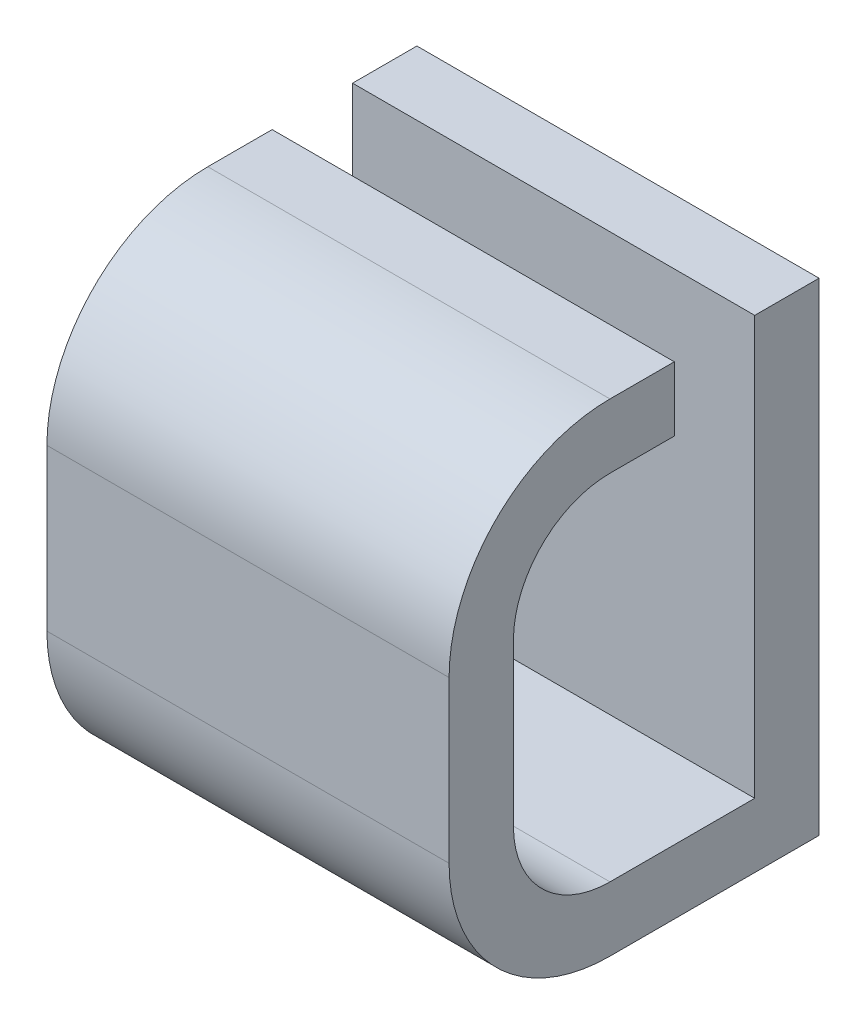
from build123d import *

# Parameters (mm, degrees)
EXTRUDE_1_DEPTH = 5


with BuildPart() as part:
    # Эскиз2 → Бобышка-Вытянуть1 (new body)
    with BuildSketch(Plane(origin=(0, 0, 0), x_dir=(0, 0, -1), z_dir=(1, 0, 0))):
        with BuildLine():
            Line((-3.01866618, 8.509074189), (-3.01866618, 2.509074189))
            Line((-3.01866618, 2.509074189), (-5.61866618, 2.509074189))
            ThreePointArc((-5.61866618, 2.509074189), (-7.032879742, 3.094860626), (-7.61866618, 4.509074189))
            Line((-7.61866618, 4.509074189), (-7.61866618, 6.509074189))
            ThreePointArc((-7.61866618, 6.509074189), (-7.032879742, 7.923287751), (-5.61866618, 8.509074189))
            Line((-5.61866618, 8.509074189), (-4.81866618, 8.509074189))
            Line((-4.81866618, 8.509074189), (-4.81866618, 7.709074189))
            Line((-4.81866618, 7.709074189), (-5.61866618, 7.709074189))
            ThreePointArc((-5.61866618, 7.709074189), (-6.467194317, 7.357602326), (-6.81866618, 6.509074189))
            Line((-6.81866618, 6.509074189), (-6.81866618, 4.509074189))
            ThreePointArc((-6.81866618, 4.509074189), (-6.467194317, 3.660546051), (-5.61866618, 3.309074189))
            Line((-5.61866618, 3.309074189), (-3.81866618, 3.309074189))
            Line((-3.81866618, 3.309074189), (-3.81866618, 8.509074189))
            Line((-3.81866618, 8.509074189), (-3.01866618, 8.509074189))
        make_face()
    extrude(amount=EXTRUDE_1_DEPTH)


solid = part.part
